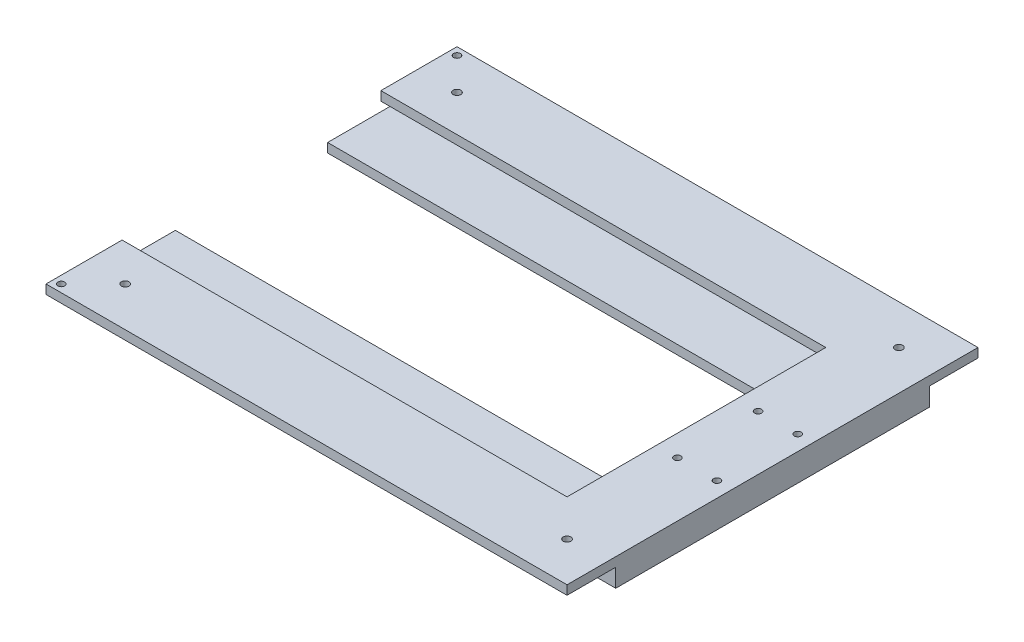
from build123d import *

# Parameters (mm, degrees)
EXTRUDE_2_DEPTH             = 6
EXTRUDE_3_DEPTH             = 6
SKETCH_4_R                  = 2.5
CUT_EXTRUDE_1_DEPTH         = 455.56865906
PATTERN_LINEAR_2_COUNT      = 2
PATTERN_LINEAR_2_PITCH      = 290.3
PATTERN_LINEAR_2_COUNT_DIR2 = 2
PATTERN_LINEAR_2_PITCH_DIR2 = 218
EXTRUDE_4_DEPTH             = 6
SKETCH_6_R                  = 2.25
CUT_EXTRUDE_2_DEPTH         = 455.766605854
SKETCH_7_R                  = 2.25
CUT_EXTRUDE_3_DEPTH         = 455.56865906


with BuildPart() as part:
    # Эскиз1 → Бобышка-Вытянуть2 (new body)
    with BuildSketch(Plane(origin=(0, 0, 0), x_dir=(1, 0, 0), z_dir=(0, 1, 0))):
        Polygon((50, -77.921508101), (50, -347.921508101), (-292.3, -347.921508101), (-292.3, -297.921508101), (0, -297.921508101), (0, -127.921508101), (-292.3, -127.921508101), (-292.3, -77.921508101), align=None)
    extrude(amount=EXTRUDE_2_DEPTH)

    # Эскиз2 → Бобышка-Вытянуть3 (add)
    with BuildSketch(Plane.XZ):
        Polygon((50, 315.921508101), (50, 109.921508101), (-292.3, 109.921508101), (-292.3, 121.921508101), (6, 121.921508101), (6, 303.921508101), (-292.3, 303.921508101), (-292.3, 315.921508101), align=None)
    extrude(amount=EXTRUDE_3_DEPTH)

    # Эскиз4 → Вырез-Вытянуть1 (cut, through all)
    with BuildSketch(Plane(origin=(0, 6, 0), x_dir=(1, 0, 0), z_dir=(0, 1, 0))):
        with Locations(Location((-266.3, -103.921508101, 0), (0, 0, 270))):
            Circle(SKETCH_4_R)
    cut_extrude_1 = extrude(amount=-CUT_EXTRUDE_1_DEPTH, mode=Mode.SUBTRACT)

    # Линейный массив2: Cut-Extrude 1 2 × 2
    with Locations(*[(i * PATTERN_LINEAR_2_PITCH, 0, j * PATTERN_LINEAR_2_PITCH_DIR2) for i in range(PATTERN_LINEAR_2_COUNT) for j in range(PATTERN_LINEAR_2_COUNT_DIR2) if (i, j) != (0, 0)]):
        add(cut_extrude_1, mode=Mode.SUBTRACT)

    # Эскиз5 → Бобышка-Вытянуть4 (add)
    with BuildSketch(Plane.XZ.offset(6)):
        Polygon((50, 315.921508101), (-292.3, 315.921508101), (-292.3, 262.921508101), (0, 262.921508101), (0, 162.921508101), (-292.3, 162.921508101), (-292.3, 109.921508101), (50, 109.921508101), align=None)
    extrude(amount=EXTRUDE_4_DEPTH)

    # Эскиз6 → Вырез-Вытянуть2 (cut, through all)
    with BuildSketch(Plane.XZ.offset(12)):
        with Locations(Location((14, 239.421508101, 0), (0, 0, 270))):
            Circle(SKETCH_6_R)
        with Locations(Location((40, 239.421508101, 0), (0, 0, 270))):
            Circle(SKETCH_6_R)
        with Locations(Location((40, 186.421508101, 0), (0, 0, 270))):
            Circle(SKETCH_6_R)
        with Locations(Location((14, 186.421508101, 0), (0, 0, 270))):
            Circle(SKETCH_6_R)
    extrude(amount=-CUT_EXTRUDE_2_DEPTH, mode=Mode.SUBTRACT)

    # Эскиз7 → Вырез-Вытянуть3 (cut, through all)
    with BuildSketch(Plane.XZ):
        with Locations(Location((-287.3, 342.921508101, 0), (0, 0, 270))):
            Circle(SKETCH_7_R)
        with Locations(Location((-287.3, 82.921508101, 0), (0, 0, 270))):
            Circle(SKETCH_7_R)
    extrude(amount=-CUT_EXTRUDE_3_DEPTH, mode=Mode.SUBTRACT)


solid = part.part
